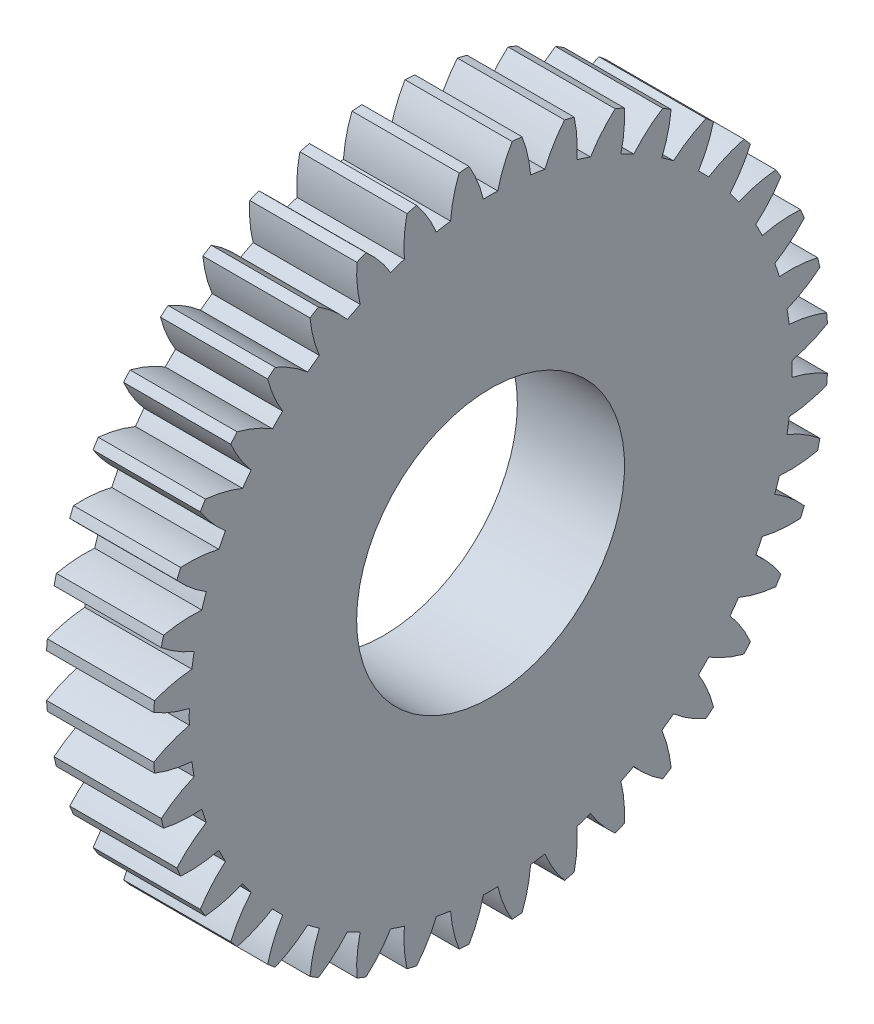
from build123d import *

# Parameters (mm, degrees)
BASPROSKE_W     = 4
BASPROSKE_H     = 12.6
TOOTHCUT_DEPTH  = 19.262529945
TEETHCUTS_COUNT = 40
TEETHCUTS_ANGLE = 351
BORSKE_R        = 5
BORE_DEPTH      = 50.0000508


with BuildPart() as part:
    # BasProSke → Base-Revolve (revolve)
    with BuildSketch(Plane(origin=(0, 0, 0), x_dir=(1, 0, 0), z_dir=(0, 1, 0)), mode=Mode.PRIVATE) as base_revolve_sk:
        with Locations((2, 6.3)):
            Rectangle(BASPROSKE_W, BASPROSKE_H)
    revolve(base_revolve_sk.sketch.rotate(Axis((-10, 0, 0), (1, 0, 0)), 180), axis=Axis((-10, 0, 0), (1, 0, 0)))

    # TooCutSke → ToothCut (cut, through all)
    with BuildSketch(Plane(origin=(0, 0, 0), x_dir=(0, 0, -1), z_dir=(1, 0, 0))):
        with BuildLine():
            ThreePointArc((0.269437699, 11.245772731), (0, 11.249), (-0.269437699, 11.245772731))
            ThreePointArc((-0.269437699, 11.245772731), (-0.49248792, 11.943313622), (-0.81905568, 12.598804426))
            ThreePointArc((-0.81905568, 12.598804426), (0, 12.6254), (0.81905568, 12.598804426))
            ThreePointArc((0.81905568, 12.598804426), (0.49248792, 11.943313622), (0.269437699, 11.245772731))
        make_face()
    toothcut = extrude(amount=TOOTHCUT_DEPTH, mode=Mode.SUBTRACT)

    # TeethCuts: ToothCut ×40 about axis
    teethcuts_axis = Axis((-10, 0, 0), (1, 0, 0))
    for i in range(1, TEETHCUTS_COUNT):
        add(toothcut.rotate(teethcuts_axis, i * TEETHCUTS_ANGLE / (TEETHCUTS_COUNT - 1)), mode=Mode.SUBTRACT)

    # BorSke → Bore (cut, symmetric)
    with BuildSketch(Plane(origin=(0, 0, 0), x_dir=(0, 0, -1), z_dir=(1, 0, 0))):
        with Locations(Location((0, 0, 0), (0, 0, 180))):
            Circle(BORSKE_R)
    extrude(amount=BORE_DEPTH, both=True, mode=Mode.SUBTRACT)


solid = part.part
